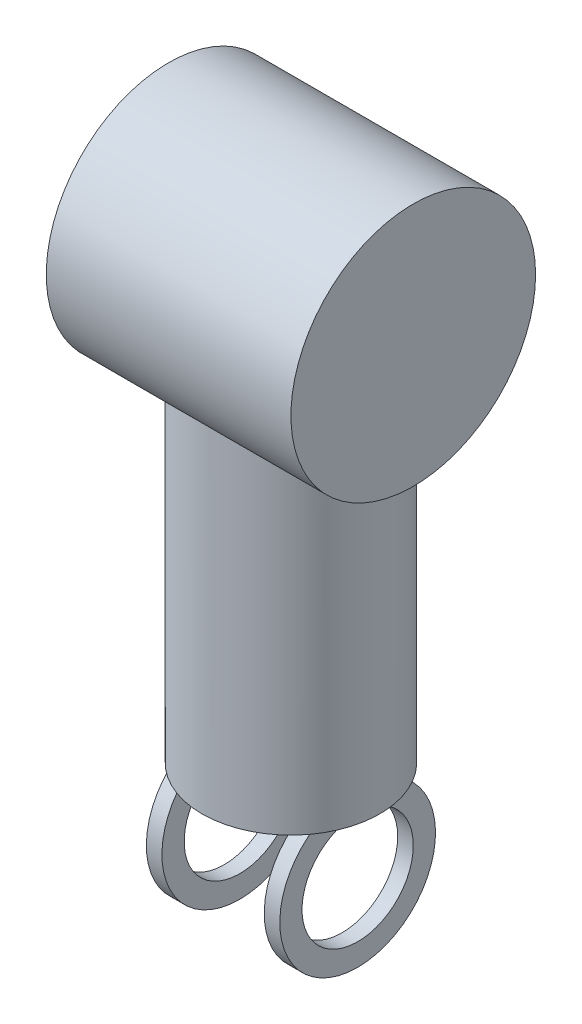
from build123d import *

# Parameters (mm, degrees)
SKETCH2_R           = 40
BOSS_EXTRUDE2_DEPTH = 190
SKETCH3_R           = 55
BOSS_EXTRUDE3_DEPTH = 55
SKETCH4_R           = 25
BOSS_EXTRUDE4_DEPTH = 7


with BuildPart() as part:
    # Sketch2 → Boss-Extrude2 (new body)
    with BuildSketch(Plane(origin=(0, 0, 0), x_dir=(1, 0, 0), z_dir=(0, 1, 0))):
        Circle(SKETCH2_R)
    extrude(amount=-BOSS_EXTRUDE2_DEPTH)

    # Sketch3 → Boss-Extrude3 (add, symmetric)
    with BuildSketch(Plane(origin=(0, 0, 0), x_dir=(0, 0, -1), z_dir=(1, 0, 0))):
        Circle(SKETCH3_R)
    extrude(amount=BOSS_EXTRUDE3_DEPTH, both=True)

    # Sketch4 → Boss-Extrude4 (add)
    with BuildSketch(Plane(origin=(30, 0, 0), x_dir=(0, 0, -1), z_dir=(1, 0, 0))):
        with BuildLine():
            Line((-18.395893308, -190), (18.395893308, -190))
            ThreePointArc((18.395893308, -190), (0, -254.775679831), (-18.395893308, -190))
        make_face()
        with Locations((0, -219.775679831)):
            Circle(SKETCH4_R, mode=Mode.SUBTRACT)
    boss_extrude4 = extrude(amount=-BOSS_EXTRUDE4_DEPTH)

    # Mirror1: Boss-Extrude4 across plane
    add(boss_extrude4.mirror(Plane(origin=(0, 0, 0), x_dir=(0, 0, 1), z_dir=(1, 0, 0))))


solid = part.part
